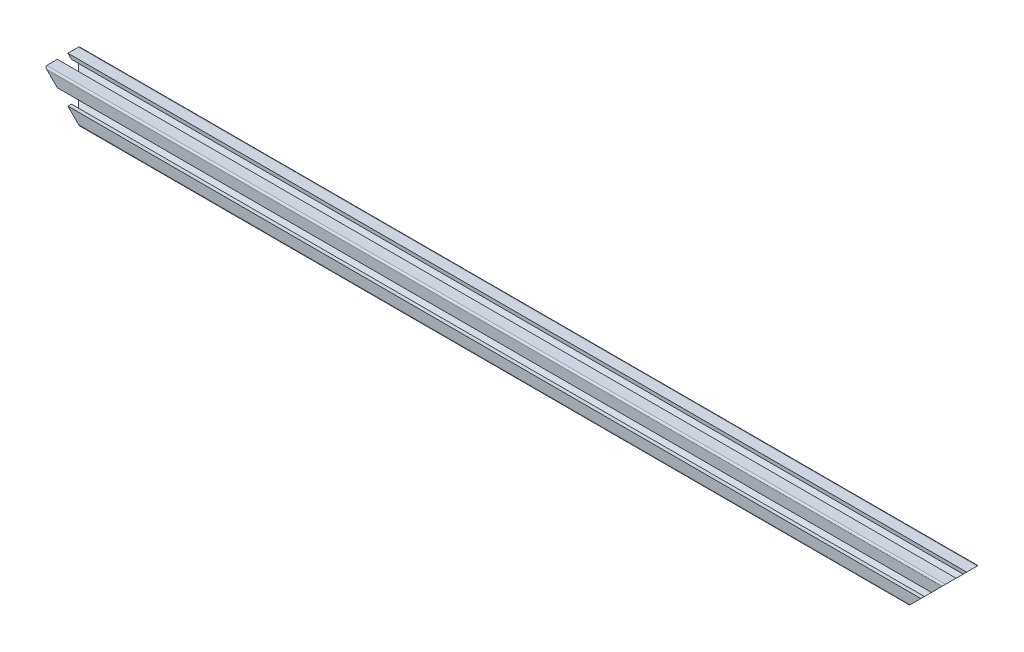
from build123d import *

# Parameters (mm, degrees)
SKETCH1_R           = 2.1
BOSS_EXTRUDE1_DEPTH = 510
CUT_EXTRUDE1_DEPTH  = 10
CUT_EXTRUDE2_DEPTH  = 10


with BuildPart() as part:
    # Sketch1 → Boss-Extrude1 (new body)
    with BuildSketch(Plane(origin=(0, 0, 0), x_dir=(0, 0, -1), z_dir=(1, 0, 0))):
        with BuildLine():
            Line((-10, 9), (-10, 3))
            Line((-10, 3), (-8, 3))
            Line((-8, 3), (-8, 6))
            Line((-8, 6), (-7.060660172, 6))
            Line((-7.060660172, 6), (-4, 2.939339828))
            Line((-4, 2.939339828), (-4, -2.939339828))
            Line((-4, -2.939339828), (-7.060660172, -6))
            Line((-7.060660172, -6), (-8, -6))
            Line((-8, -6), (-8, -3))
            Line((-8, -3), (-10, -3))
            Line((-10, -3), (-10, -9))
            ThreePointArc((-10, -9), (-9.707106781, -9.707106781), (-9, -10))
            Line((-9, -10), (-3, -10))
            Line((-3, -10), (-3, -8))
            Line((-3, -8), (-6, -8))
            Line((-6, -8), (-6, -7.060660172))
            Line((-6, -7.060660172), (-2.939339828, -4))
            Line((-2.939339828, -4), (2.939339828, -4))
            Line((2.939339828, -4), (6, -7.060660172))
            Line((6, -7.060660172), (6, -8))
            Line((6, -8), (3, -8))
            Line((3, -8), (3, -10))
            Line((3, -10), (9, -10))
            ThreePointArc((9, -10), (9.707106781, -9.707106781), (10, -9))
            Line((10, -9), (10, -3))
            Line((10, -3), (8, -3))
            Line((8, -3), (8, -6))
            Line((8, -6), (7.060660172, -6))
            Line((7.060660172, -6), (4, -2.939339828))
            Line((4, -2.939339828), (4, 2.939339828))
            Line((4, 2.939339828), (7.060660172, 6))
            Line((7.060660172, 6), (8, 6))
            Line((8, 6), (8, 3))
            Line((8, 3), (10, 3))
            Line((10, 3), (10, 9))
            ThreePointArc((10, 9), (9.707106781, 9.707106781), (9, 10))
            Line((9, 10), (3, 10))
            Line((3, 10), (3, 8))
            Line((3, 8), (6, 8))
            Line((6, 8), (6, 7.060660172))
            Line((6, 7.060660172), (2.939339828, 4))
            Line((2.939339828, 4), (-2.939339828, 4))
            Line((-2.939339828, 4), (-6, 7.060660172))
            Line((-6, 7.060660172), (-6, 8))
            Line((-6, 8), (-3, 8))
            Line((-3, 8), (-3, 10))
            Line((-3, 10), (-9, 10))
            ThreePointArc((-9, 10), (-9.707106781, 9.707106781), (-10, 9))
        make_face()
        Circle(SKETCH1_R, mode=Mode.SUBTRACT)
    extrude(amount=BOSS_EXTRUDE1_DEPTH)

    # Sketch28 → Cut-Extrude1 (cut, symmetric)
    with BuildSketch(Plane.XY):
        Polygon((0, 10), (0, -10), (20, -10), align=None)
    extrude(amount=CUT_EXTRUDE1_DEPTH, both=True, mode=Mode.SUBTRACT)

    # Sketch29 → Cut-Extrude2 (cut, symmetric)
    with BuildSketch(Plane.XY):
        Polygon((510, 10), (510, -10), (490, -10), align=None)
    extrude(amount=CUT_EXTRUDE2_DEPTH, both=True, mode=Mode.SUBTRACT)


solid = part.part
